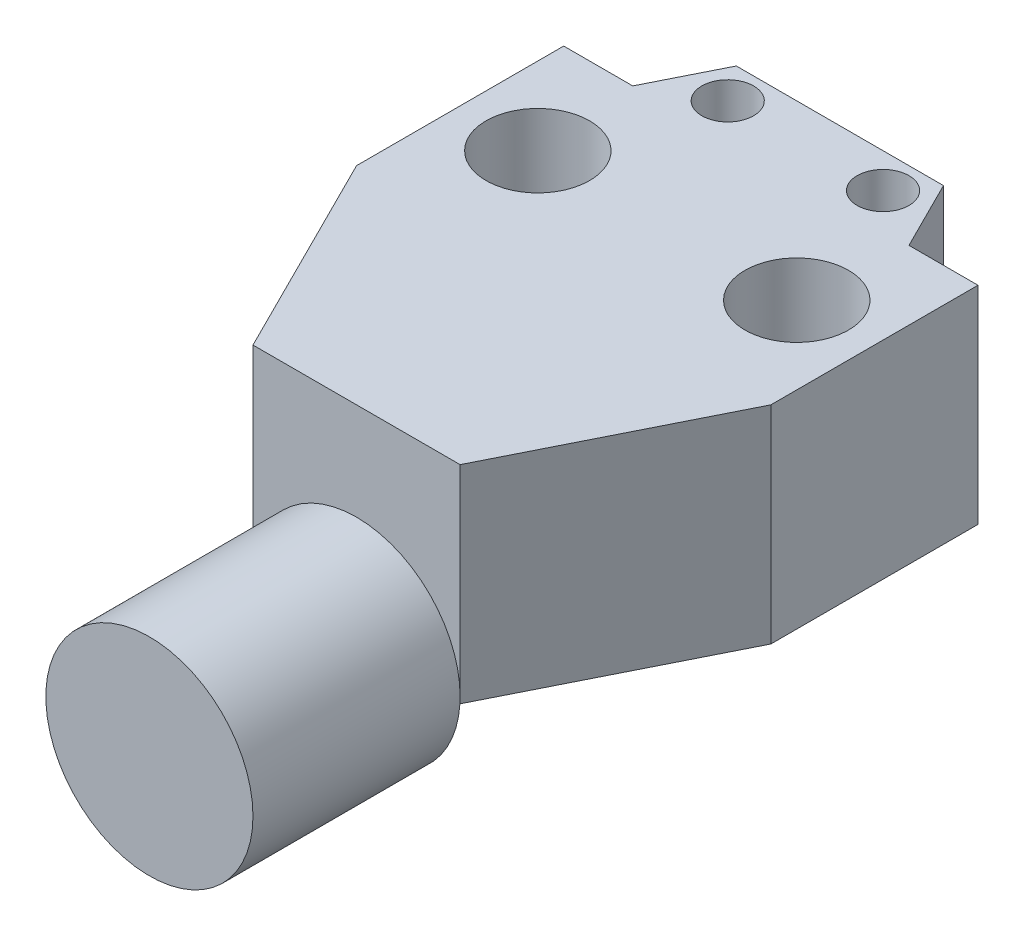
from build123d import *

# Parameters (mm, degrees)
SKETCH1_R           = 39.6875
SKETCH1_R_2         = 19.84375
BOSS_EXTRUDE1_DEPTH = 158.75
SKETCH2_R           = 79.375
BOSS_EXTRUDE2_DEPTH = 158.75


with BuildPart() as part:
    # Sketch1 → Boss-Extrude1 (new body)
    with BuildSketch(Plane(origin=(0, 0, 0), x_dir=(1, 0, 0), z_dir=(0, 1, 0))):
        Polygon((158.75, -79.375), (79.375, -238.125), (-79.375, -238.125), (-158.75, -79.375), (-158.75, 79.375), (-105.833333333, 79.375), (-79.375, 132.291666667), (0, 132.291666667), (79.375, 132.291666667), (105.833333333, 79.375), (158.75, 79.375), align=None)
        with Locations(Location((-99.21875, 0, 0), (0, 0, 90))):
            Circle(SKETCH1_R, mode=Mode.SUBTRACT)
        with Locations(Location((99.21875, 0, 0), (0, 0, 90))):
            Circle(SKETCH1_R, mode=Mode.SUBTRACT)
        with Locations(Location((-59.53125, 105.833333333, 0), (0, 0, 90))):
            Circle(SKETCH1_R_2, mode=Mode.SUBTRACT)
        with Locations(Location((59.53125, 105.833333333, 0), (0, 0, 90))):
            Circle(SKETCH1_R_2, mode=Mode.SUBTRACT)
    extrude(amount=BOSS_EXTRUDE1_DEPTH)

    # Sketch2 → Boss-Extrude2 (add)
    with BuildSketch(Plane.XY.offset(238.125)):
        with Locations((0, 4.842306375)):
            Circle(SKETCH2_R)
    extrude(amount=BOSS_EXTRUDE2_DEPTH)


solid = part.part
